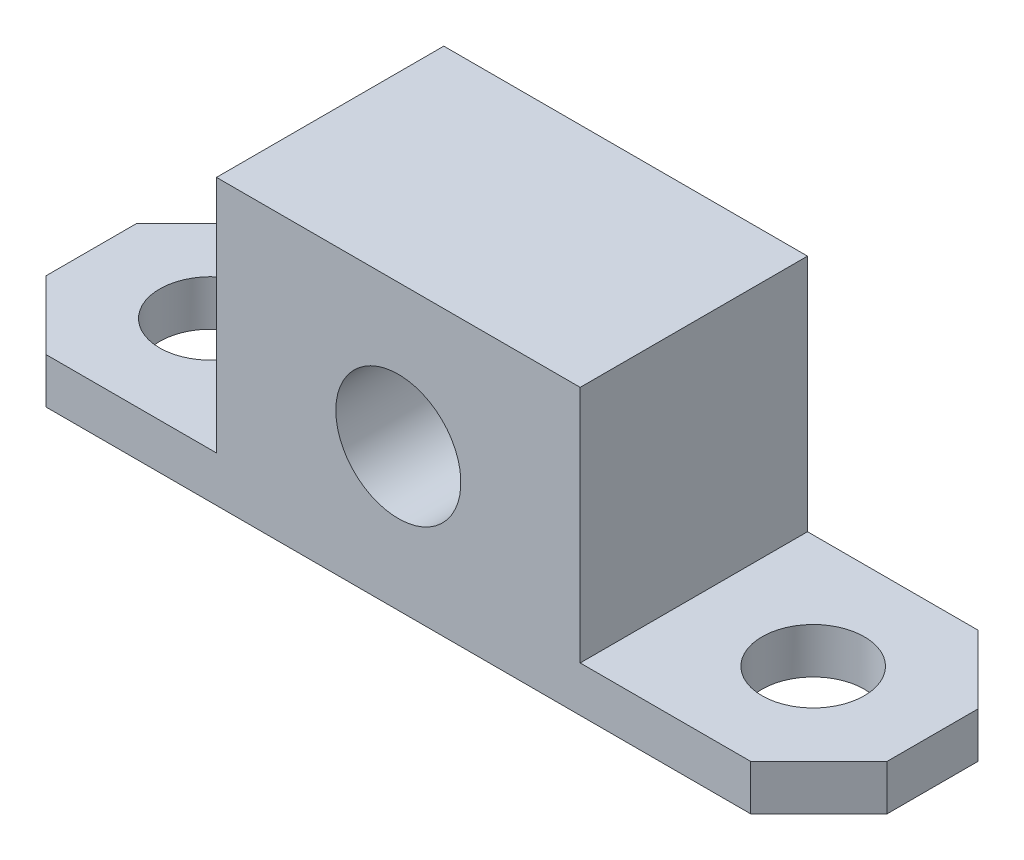
from build123d import *

# Parameters (mm, degrees)
SKETCH1_W           = 37
SKETCH1_H           = 10
BOSS_EXTRUDE1_DEPTH = 2
SKETCH2_W           = 16
SKETCH2_H           = 10
BOSS_EXTRUDE2_DEPTH = 10.5
SKETCH3_R           = 2.75
CUT_EXTRUDE1_DEPTH  = 41.314389491
SKETCH4_R           = 2.25
CUT_EXTRUDE2_DEPTH  = 10
CHAMFER1_SIZE       = 3


with BuildPart() as part:
    # Sketch1 → Boss-Extrude1 (new body)
    with BuildSketch(Plane(origin=(0, 0, 0), x_dir=(1, 0, 0), z_dir=(0, 1, 0))):
        with Locations((18.5, 5)):
            Rectangle(SKETCH1_W, SKETCH1_H)
    extrude(amount=BOSS_EXTRUDE1_DEPTH)

    # Sketch2 → Boss-Extrude2 (add)
    with BuildSketch(Plane(origin=(0, 2, 0), x_dir=(1, 0, 0), z_dir=(0, 1, 0))):
        with Locations((18.5, 5)):
            Rectangle(SKETCH2_W, SKETCH2_H)
    extrude(amount=BOSS_EXTRUDE2_DEPTH)

    # Sketch3 → Cut-Extrude1 (cut, through all)
    with BuildSketch(Plane(origin=(0, 0, -10), x_dir=(-1, 0, 0), z_dir=(0, 0, -1))):
        with Locations((-18.5, 6.25)):
            Circle(SKETCH3_R)
    extrude(amount=-CUT_EXTRUDE1_DEPTH, mode=Mode.SUBTRACT)

    # Sketch4 → Cut-Extrude2 (cut)
    with BuildSketch(Plane(origin=(0, 2, 0), x_dir=(1, 0, 0), z_dir=(0, 1, 0))):
        with Locations(Location((5.25, 5, 0), (0, 0, 270))):
            Circle(SKETCH4_R)
        with Locations(Location((31.75, 5, 0), (0, 0, 270))):
            Circle(SKETCH4_R)
    extrude(amount=-CUT_EXTRUDE2_DEPTH, mode=Mode.SUBTRACT)

    # Chamfer1
    chamfer1_edges = [part.edges().sort_by_distance(p)[0] for p in [
        (0, 1, -10),
        (37, 1, -10),
        (37, 1, 0),
        (0, 1, 0),
    ]]
    chamfer(chamfer1_edges, length=CHAMFER1_SIZE)


solid = part.part
